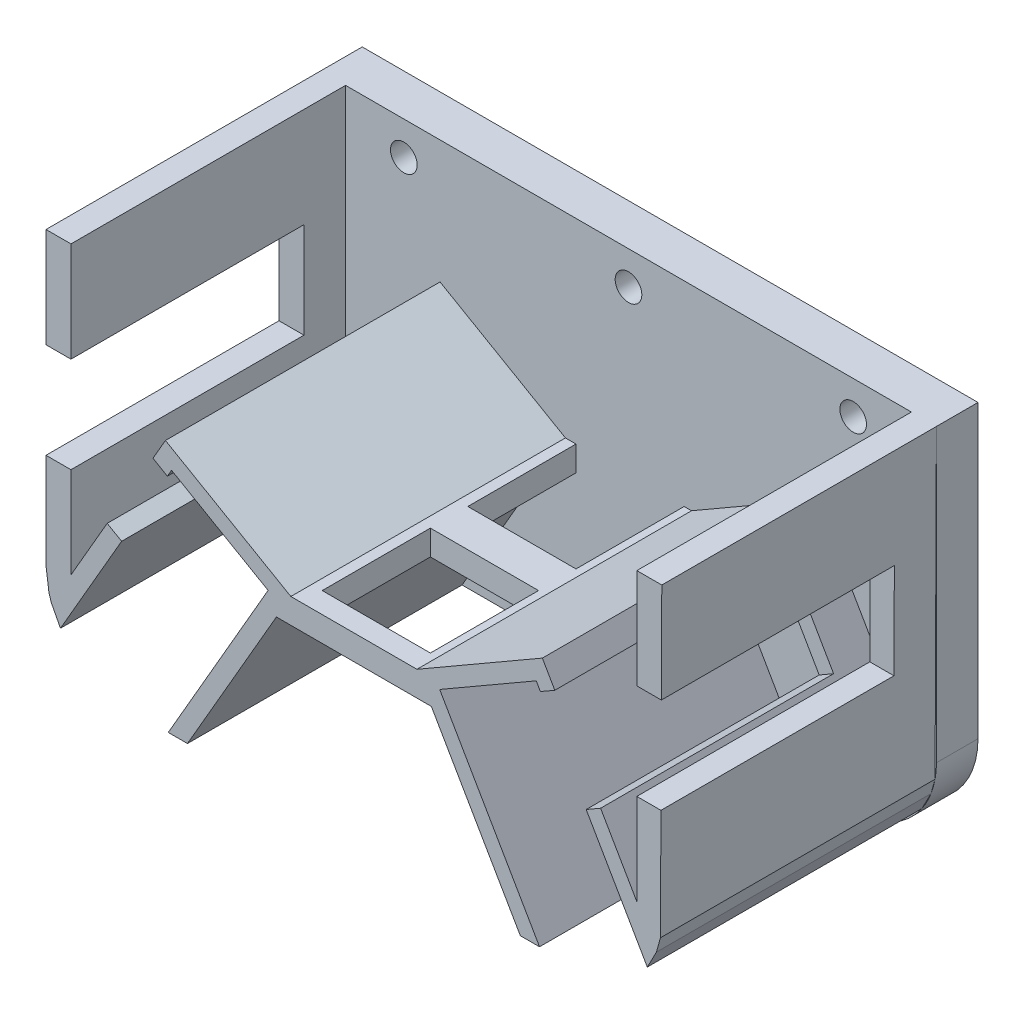
from build123d import *

# Parameters (mm, degrees)
SKETCH_1_W          = 74
SKETCH_1_H          = 45
EXTRUDE_1_DEPTH     = 5
FILLET_1_R          = 10
FILLET_2_R          = 10
EXTRUDE_3_DEPTH     = 33
EXTRUDE_4_DEPTH     = 33
SKETCH_6_W          = 13
SKETCH_6_H          = 13
CUT_EXTRUDE_1_DEPTH = 60.282099079
CUT_EXTRUDE_3_DEPTH = 28
EXTRUDE_5_DEPTH     = 33
SKETCH_10_W         = 3
SKETCH_10_H         = 11.5
CUT_EXTRUDE_4_DEPTH = 28
SKETCH_11_R         = 1.6
CUT_EXTRUDE_5_DEPTH = 10


with BuildPart() as part:
    # 草图1 → 凸台-拉伸1 (new body)
    with BuildSketch(Plane.XY):
        Rectangle(SKETCH_1_W, SKETCH_1_H)
    extrude(amount=EXTRUDE_1_DEPTH)

    # 圆角1
    fillet_1_edges = [part.edges().sort_by_distance(p)[0] for p in [
        (-37, -22.5, 2.5),
    ]]
    fillet(fillet_1_edges, radius=FILLET_1_R)

    # 圆角2
    fillet_2_edges = [part.edges().sort_by_distance(p)[0] for p in [
        (37, -22.5, 2.5),
    ]]
    fillet(fillet_2_edges, radius=FILLET_2_R)

    # 草图4 → 凸台-拉伸3 (add)
    with BuildSketch(Plane.XY.offset(5)):
        Polygon((-35.261752955, -18.134131531), (-21.914141487, 4.984609691), (-10.309401077, -1.715390309), (-22.309401077, -22.5), (-20, -22.5), (-7.577350269, -0.983339502), (-22.646192295, 7.716660498), (-36.356272702, -16.029895342), align=None)
        Polygon((36.356272702, -16.029895342), (35.261752955, -18.134131531), (21.914141487, 4.984609691), (10.309401077, -1.715390309), (22.309401077, -22.5), (20, -22.5), (7.577350269, -0.983339502), (22.646192295, 7.716660498), align=None)
    extrude(amount=EXTRUDE_3_DEPTH)

    # 草图5 → 凸台-拉伸4 (add)
    with BuildSketch(Plane.XY.offset(5)):
        Polygon((-7.577350269, -0.983339502), (7.577350269, -0.983339502), (9.309401077, -3.983339502), (-9.309401077, -3.983339502), align=None)
    extrude(amount=EXTRUDE_4_DEPTH)

    # 草图6 → 切除-拉伸1 (cut, through all)
    with BuildSketch(Plane.XZ.offset(3.983339502)):
        with Locations((0.190598923, 29)):
            Rectangle(SKETCH_6_W, SKETCH_6_H)
        with Locations((0.190598923, 11.5)):
            Rectangle(SKETCH_6_W, SKETCH_6_H)
    extrude(amount=-CUT_EXTRUDE_1_DEPTH, mode=Mode.SUBTRACT)

    # 草图8 → 切除-拉伸3 (cut)
    with BuildSketch(Plane.XY.offset(38)):
        Polygon((-29.646192295, -4.407695155), (-24.146192295, 5.118584287), (-22.414141487, 4.118584287), (-27.914141487, -5.407695155), align=None)
        Polygon((27.914141487, -5.407695155), (29.646192295, -4.407695155), (24.146192295, 5.118584287), (22.414141487, 4.118584287), align=None)
    extrude(amount=-CUT_EXTRUDE_3_DEPTH, mode=Mode.SUBTRACT)

    # 草图9 → 凸台-拉伸5 (add)
    with BuildSketch(Plane.XY.offset(5)):
        Polygon((-34, 22.5), (-37, 22.5), (-37, -12.5), (-36.638694465, -15.163750927), (-36.356272702, -16.029895342), (-34, -11.948711306), align=None)
        Polygon((36.356272702, -16.029895342), (34, -11.948711306), (34, 22.5), (37, 22.5), (36.837751954, -14.294055877), align=None)
    extrude(amount=EXTRUDE_5_DEPTH)

    # 草图10 → 切除-拉伸4 (cut)
    with BuildSketch(Plane.XY.offset(38)):
        with Locations((-35.5, 4.75)):
            Rectangle(SKETCH_10_W, SKETCH_10_H)
        with Locations((35.5, 4.75)):
            Rectangle(SKETCH_10_W, SKETCH_10_H)
    extrude(amount=-CUT_EXTRUDE_4_DEPTH, mode=Mode.SUBTRACT)

    # 草图11 → 切除-拉伸5 (cut)
    with BuildSketch(Plane.XY.offset(5)):
        with Locations((-27, 18.5)):
            Circle(SKETCH_11_R)
        with Locations((0, 18.5)):
            Circle(SKETCH_11_R)
        with Locations((27, 18.5)):
            Circle(SKETCH_11_R)
    extrude(amount=-CUT_EXTRUDE_5_DEPTH, mode=Mode.SUBTRACT)


solid = part.part
